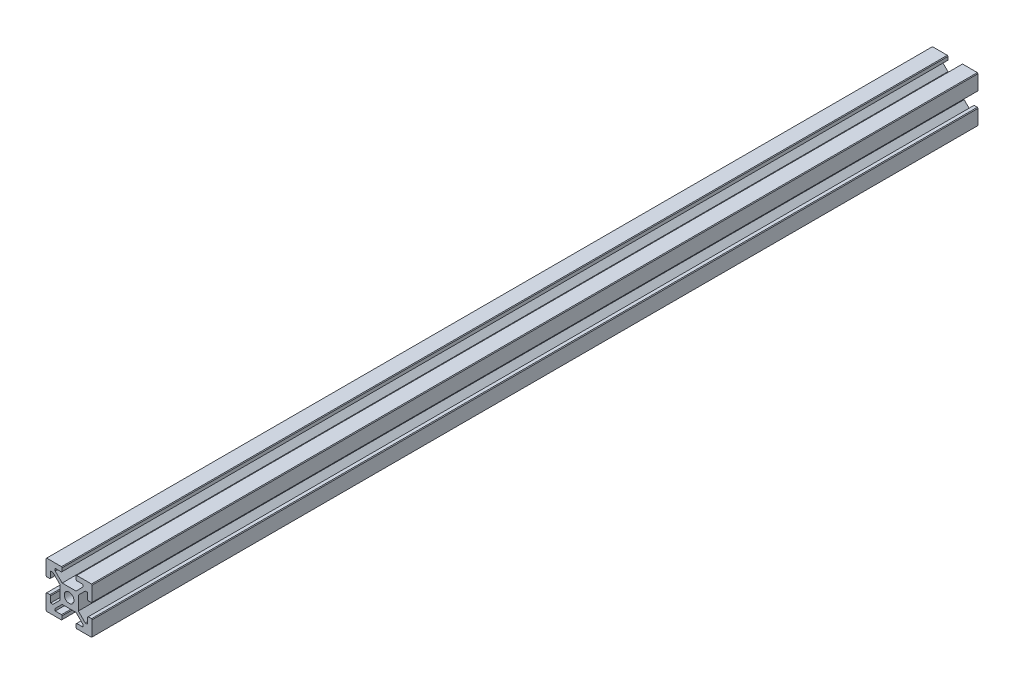
from build123d import *

# Parameters (mm, degrees)
SKETCH1_R           = 2.1
BOSS_EXTRUDE1_DEPTH = 383.54
CHAMFER1_SIZE       = 0.2828


with BuildPart() as part:
    # Sketch1 → Boss-Extrude1 (new body)
    with BuildSketch(Plane.XY):
        Polygon((-3, 8), (-3, 10), (-10, 10), (-10, 3), (-8, 3), (-8, 6), (-7, 6), (-4, 3), (-4, -3), (-7, -6), (-8, -6), (-8, -3), (-10, -3), (-10, -10), (-3, -10), (-3, -8), (-6, -8), (-6, -7), (-3, -4), (3, -4), (6, -7), (6, -8), (3, -8), (3, -10), (10, -10), (10, -3), (8, -3), (8, -6), (7, -6), (4, -3), (4, 3), (7, 6), (8, 6), (8, 3), (10, 3), (10, 10), (3, 10), (3, 8), (6, 8), (6, 7), (3, 4), (-3, 4), (-6, 7), (-6, 8), align=None)
        Circle(SKETCH1_R, mode=Mode.SUBTRACT)
    extrude(amount=BOSS_EXTRUDE1_DEPTH)

    # Chamfer1
    chamfer1_edges = [part.edges().sort_by_distance(p)[0] for p in [
        (-8, -3, 191.77),
        (-8, 3, 191.77),
        (-10, 3, 191.77),
        (-10, 10, 191.77),
        (-3, 10, 191.77),
        (-3, 8, 191.77),
        (3, 8, 191.77),
        (3, 10, 191.77),
        (10, 10, 191.77),
        (10, 3, 191.77),
        (8, 3, 191.77),
        (8, -3, 191.77),
        (10, -3, 191.77),
        (10, -10, 191.77),
        (3, -10, 191.77),
        (3, -8, 191.77),
        (-3, -8, 191.77),
        (-3, -10, 191.77),
        (-10, -10, 191.77),
        (-10, -3, 191.77),
    ]]
    chamfer(chamfer1_edges, length=CHAMFER1_SIZE)


solid = part.part
